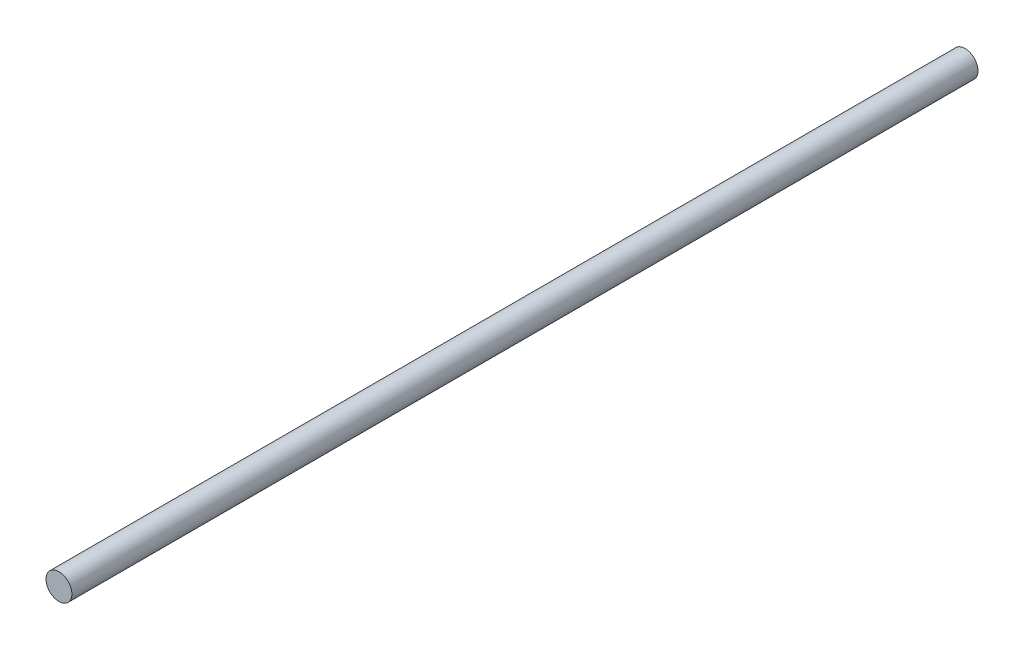
from build123d import *

# Parameters (mm, degrees)
ESQUISSE1_R        = 10
BOSS_EXTRU_1_DEPTH = 700


with BuildPart() as part:
    # Esquisse1 → Boss.-Extru.1 (new body)
    with BuildSketch(Plane.XY):
        Circle(ESQUISSE1_R)
    extrude(amount=BOSS_EXTRU_1_DEPTH)


solid = part.part
